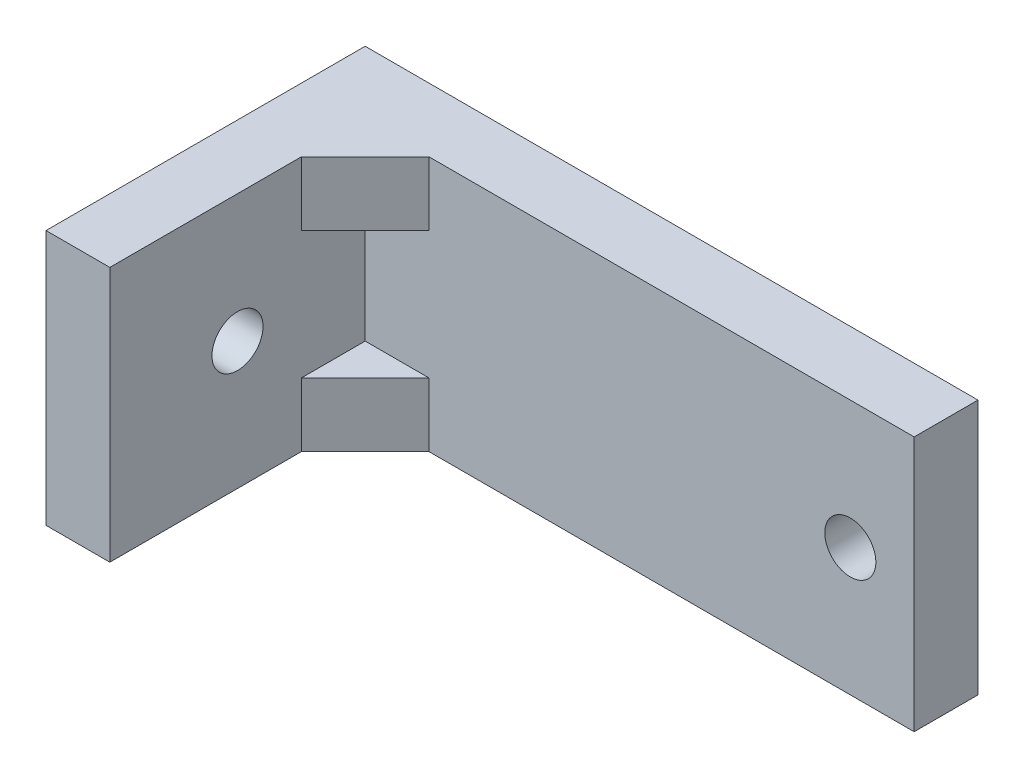
from build123d import *

# Parameters (mm, degrees)
SKETCH1_W           = 48
SKETCH1_H           = 20
BOSS_EXTRUDE1_DEPTH = 5
SKETCH2_W           = 5
SKETCH2_H           = 20
BOSS_EXTRUDE2_DEPTH = 20
SKETCH3_R           = 2
CUT_EXTRUDE1_DEPTH  = 51.734603576
SKETCH5_W           = 5
SKETCH5_H           = 5
BOSS_EXTRUDE3_DEPTH = 5
CUT_EXTRUDE3_DEPTH  = 41.012498047
SKETCH7_R           = 2
CUT_EXTRUDE4_DEPTH  = 37.069377594


with BuildPart() as part:
    # Sketch1 → Boss-Extrude1 (new body)
    with BuildSketch(Plane.XY):
        Rectangle(SKETCH1_W, SKETCH1_H)
    extrude(amount=BOSS_EXTRUDE1_DEPTH)

    # Sketch2 → Boss-Extrude2 (add)
    with BuildSketch(Plane.XY.offset(5)):
        with Locations((-21.5, 0)):
            Rectangle(SKETCH2_W, SKETCH2_H)
    extrude(amount=BOSS_EXTRUDE2_DEPTH)

    # Sketch3 → Cut-Extrude1 (cut, through all)
    with BuildSketch(Plane(origin=(-19, 0, 0), x_dir=(0, 0, -1), z_dir=(1, 0, 0))):
        with Locations((-15, 0)):
            Circle(SKETCH3_R)
    extrude(amount=-CUT_EXTRUDE1_DEPTH, mode=Mode.SUBTRACT)

    # Sketch5 → Boss-Extrude3 (add)
    with BuildSketch(Plane(origin=(-19, 0, 0), x_dir=(0, 0, -1), z_dir=(1, 0, 0))):
        with Locations((-7.5, -7.5)):
            Rectangle(SKETCH5_W, SKETCH5_H)
        with Locations((-7.5, 7.5)):
            Rectangle(SKETCH5_W, SKETCH5_H)
    extrude(amount=BOSS_EXTRUDE3_DEPTH)

    # Sketch6 → Cut-Extrude3 (cut, through all)
    with BuildSketch(Plane(origin=(0, 10, 0), x_dir=(1, 0, 0), z_dir=(0, 1, 0))):
        Polygon((-14, -5), (-19, -10), (-14, -10), align=None)
    extrude(amount=-CUT_EXTRUDE3_DEPTH, mode=Mode.SUBTRACT)

    # Sketch7 → Cut-Extrude4 (cut, through all)
    with BuildSketch(Plane(origin=(0, 0, 0), x_dir=(-1, 0, 0), z_dir=(0, 0, -1))):
        with Locations((-19, 0)):
            Circle(SKETCH7_R)
    extrude(amount=-CUT_EXTRUDE4_DEPTH, mode=Mode.SUBTRACT)


solid = part.part
